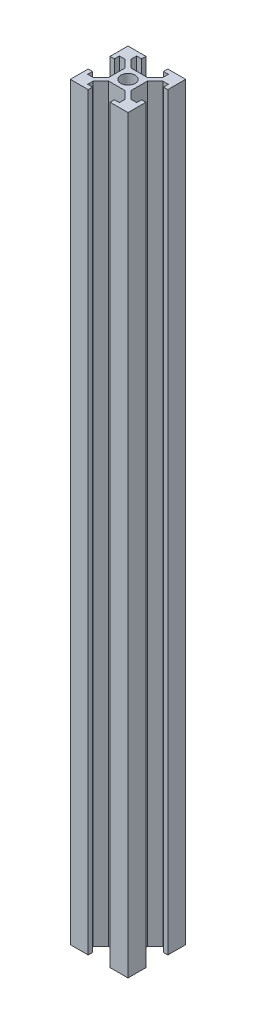
from build123d import *

# Parameters (mm, degrees)
SKETCH_1_W      = 1.5
SKETCH_1_H      = 1.7
SKETCH_1_W_2    = 1.7
SKETCH_1_H_2    = 1.5
SKETCH_1_W_3    = 7.8
SKETCH_1_H_3    = 7.8
SKETCH_1_R      = 2.5
EXTRUDE_1_DEPTH = 260


with BuildPart() as part:
    # 草图1 → 凸台-拉伸1 (new body)
    # profile 1 of 17: a face of its own
    with BuildSketch(Plane(origin=(0, 0, 0), x_dir=(1, 0, 0), z_dir=(0, 1, 0))):
        Polygon((5.5, 8.5), (5.5, 6.560660172), (5.5, 5.5), (6.560660172, 5.5), (8.5, 5.5), (10, 5.5), (10, 10), (5.5, 10), align=None)
    # profile 2 of 17: a face of its own
    with BuildSketch(Plane(origin=(0, 0, 0), x_dir=(1, 0, 0), z_dir=(0, 1, 0))):
        with Locations((9.25, 4.65)):
            Rectangle(SKETCH_1_W, SKETCH_1_H)
    # profile 3 of 17: a face of its own
    with BuildSketch(Plane(origin=(0, 0, 0), x_dir=(1, 0, 0), z_dir=(0, 1, 0))):
        Polygon((5.5, 6.560660172), (2.839339828, 3.9), (3.9, 3.9), (3.9, 2.839339828), (6.560660172, 5.5), (5.5, 5.5), align=None)
    # profile 4 of 17: a face of its own
    with BuildSketch(Plane(origin=(0, 0, 0), x_dir=(1, 0, 0), z_dir=(0, 1, 0))):
        with Locations((4.65, 9.25)):
            Rectangle(SKETCH_1_W_2, SKETCH_1_H_2)
    # profile 5 of 17: a face of its own
    with BuildSketch(Plane(origin=(0, 0, 0), x_dir=(1, 0, 0), z_dir=(0, 1, 0))):
        Rectangle(SKETCH_1_W_3, SKETCH_1_H_3)
        with Locations(Location((0, 0, 0), (0, 0, 270))):
            Circle(SKETCH_1_R, mode=Mode.SUBTRACT)
    # profile 6 of 17: a face of its own
    with BuildSketch(Plane(origin=(0, 0, 0), x_dir=(1, 0, 0), z_dir=(0, 1, 0))):
        with Locations((-4.65, 9.25)):
            Rectangle(SKETCH_1_W_2, SKETCH_1_H_2)
    # profile 7 of 17: a face of its own
    with BuildSketch(Plane(origin=(0, 0, 0), x_dir=(1, 0, 0), z_dir=(0, 1, 0))):
        Polygon((-8.5, 5.5), (-6.560660172, 5.5), (-5.5, 5.5), (-5.5, 6.560660172), (-5.5, 8.5), (-5.5, 10), (-10, 10), (-10, 5.5), align=None)
    # profile 8 of 17: a face of its own
    with BuildSketch(Plane(origin=(0, 0, 0), x_dir=(1, 0, 0), z_dir=(0, 1, 0))):
        with Locations((-9.25, 4.65)):
            Rectangle(SKETCH_1_W, SKETCH_1_H)
    # profile 9 of 17: a face of its own
    with BuildSketch(Plane(origin=(0, 0, 0), x_dir=(1, 0, 0), z_dir=(0, 1, 0))):
        Polygon((-5.5, 5.5), (-6.560660172, 5.5), (-3.9, 2.839339828), (-3.9, 3.9), (-2.839339828, 3.9), (-5.5, 6.560660172), align=None)
    # profile 10 of 17: a face of its own
    with BuildSketch(Plane(origin=(0, 0, 0), x_dir=(1, 0, 0), z_dir=(0, 1, 0))):
        Polygon((-5.5, -5.5), (-6.560660172, -5.5), (-8.5, -5.5), (-10, -5.5), (-10, -10), (-5.5, -10), (-5.5, -8.5), (-5.5, -6.560660172), align=None)
    # profile 11 of 17: a face of its own
    with BuildSketch(Plane(origin=(0, 0, 0), x_dir=(1, 0, 0), z_dir=(0, 1, 0))):
        with Locations((-4.65, -9.25)):
            Rectangle(SKETCH_1_W_2, SKETCH_1_H_2)
    # profile 12 of 17: a face of its own
    with BuildSketch(Plane(origin=(0, 0, 0), x_dir=(1, 0, 0), z_dir=(0, 1, 0))):
        with Locations((-9.25, -4.65)):
            Rectangle(SKETCH_1_W, SKETCH_1_H)
    # profile 13 of 17: a face of its own
    with BuildSketch(Plane(origin=(0, 0, 0), x_dir=(1, 0, 0), z_dir=(0, 1, 0))):
        Polygon((-3.9, -3.9), (-3.9, -2.839339828), (-6.560660172, -5.5), (-5.5, -5.5), (-5.5, -6.560660172), (-2.839339828, -3.9), align=None)
    # profile 14 of 17: a face of its own
    with BuildSketch(Plane(origin=(0, 0, 0), x_dir=(1, 0, 0), z_dir=(0, 1, 0))):
        Polygon((3.9, -3.9), (2.839339828, -3.9), (5.5, -6.560660172), (5.5, -5.5), (6.560660172, -5.5), (3.9, -2.839339828), align=None)
    # profile 15 of 17: a face of its own
    with BuildSketch(Plane(origin=(0, 0, 0), x_dir=(1, 0, 0), z_dir=(0, 1, 0))):
        Polygon((5.5, -5.5), (5.5, -6.560660172), (5.5, -8.5), (5.5, -10), (10, -10), (10, -5.5), (8.5, -5.5), (6.560660172, -5.5), align=None)
    # profile 16 of 17: a face of its own
    with BuildSketch(Plane(origin=(0, 0, 0), x_dir=(1, 0, 0), z_dir=(0, 1, 0))):
        with Locations((9.25, -4.65)):
            Rectangle(SKETCH_1_W, SKETCH_1_H)
    # profile 17 of 17: a face of its own
    with BuildSketch(Plane(origin=(0, 0, 0), x_dir=(1, 0, 0), z_dir=(0, 1, 0))):
        with Locations((4.65, -9.25)):
            Rectangle(SKETCH_1_W_2, SKETCH_1_H_2)
    extrude(amount=EXTRUDE_1_DEPTH)


solid = part.part
